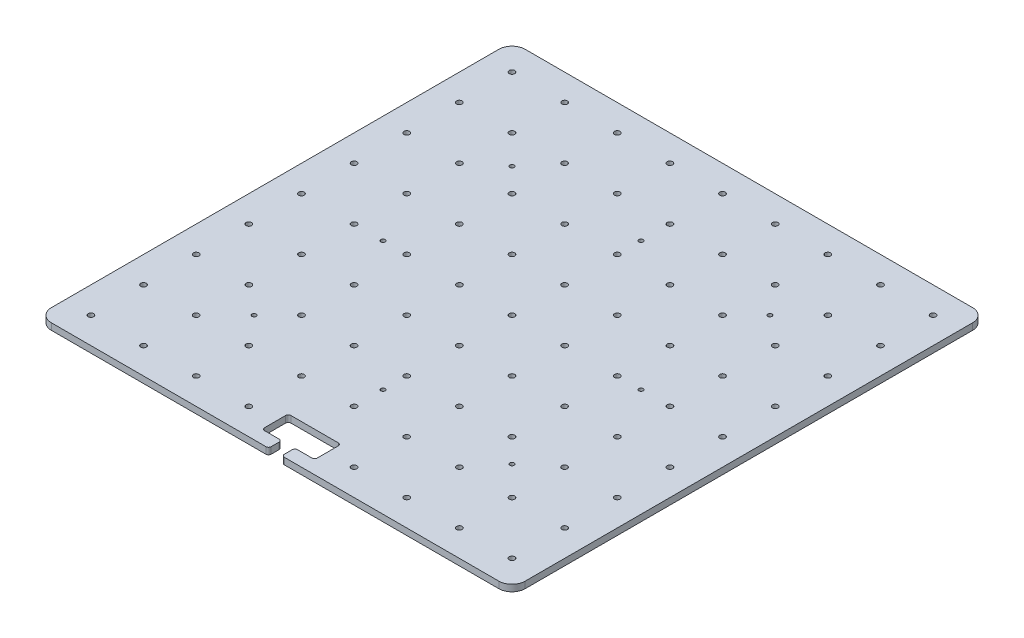
from build123d import *

# Parameters (mm, degrees)
SKETCH_1_W          = 360
SKETCH_1_H          = 360
EXTRUDE_1_DEPTH     = 5
SKETCH_2_R          = 2.1
CUT_EXTRUDE_1_DEPTH = 255.607541129
FILLET_1_R          = 10
CUT_EXTRUDE_2_DEPTH = 255.607541129
SKETCH_4_R          = 1.6
CUT_EXTRUDE_3_DEPTH = 10
FILLET_2_R          = 2


with BuildPart() as part:
    # 草图1 → 凸台-拉伸1 (new body)
    with BuildSketch(Plane(origin=(0, 0, 0), x_dir=(1, 0, 0), z_dir=(0, 1, 0))):
        Rectangle(SKETCH_1_W, SKETCH_1_H)
    extrude(amount=EXTRUDE_1_DEPTH)

    # 草图2 → 切除-拉伸1 (cut, through all)
    with BuildSketch(Plane(origin=(0, 5, 0), x_dir=(1, 0, 0), z_dir=(0, 1, 0))):
        with Locations(Location((0, 0, 0), (0, 0, 270))):
            Circle(SKETCH_2_R)
        with Locations(Location((40, 0, 0), (0, 0, 270))):
            Circle(SKETCH_2_R)
        with Locations(Location((80, 0, 0), (0, 0, 270))):
            Circle(SKETCH_2_R)
        with Locations(Location((120, 0, 0), (0, 0, 270))):
            Circle(SKETCH_2_R)
        with Locations(Location((160, 0, 0), (0, 0, 270))):
            Circle(SKETCH_2_R)
        with Locations(Location((40, 40, 0), (0, 0, 270))):
            Circle(SKETCH_2_R)
        with Locations(Location((80, 40, 0), (0, 0, 270))):
            Circle(SKETCH_2_R)
        with Locations(Location((120, 40, 0), (0, 0, 270))):
            Circle(SKETCH_2_R)
        with Locations(Location((160, 40, 0), (0, 0, 270))):
            Circle(SKETCH_2_R)
        with Locations(Location((40, 80, 0), (0, 0, 270))):
            Circle(SKETCH_2_R)
        with Locations(Location((80, 80, 0), (0, 0, 270))):
            Circle(SKETCH_2_R)
        with Locations(Location((120, 80, 0), (0, 0, 270))):
            Circle(SKETCH_2_R)
        with Locations(Location((160, 80, 0), (0, 0, 270))):
            Circle(SKETCH_2_R)
        with Locations(Location((40, 120, 0), (0, 0, 270))):
            Circle(SKETCH_2_R)
        with Locations(Location((80, 120, 0), (0, 0, 270))):
            Circle(SKETCH_2_R)
        with Locations(Location((120, 120, 0), (0, 0, 270))):
            Circle(SKETCH_2_R)
        with Locations(Location((160, 120, 0), (0, 0, 270))):
            Circle(SKETCH_2_R)
        with Locations(Location((40, 160, 0), (0, 0, 270))):
            Circle(SKETCH_2_R)
        with Locations(Location((80, 160, 0), (0, 0, 270))):
            Circle(SKETCH_2_R)
        with Locations(Location((120, 160, 0), (0, 0, 270))):
            Circle(SKETCH_2_R)
        with Locations(Location((160, 160, 0), (0, 0, 270))):
            Circle(SKETCH_2_R)
        with Locations(Location((0, 40, 0), (0, 0, 270))):
            Circle(SKETCH_2_R)
        with Locations(Location((0, 80, 0), (0, 0, 270))):
            Circle(SKETCH_2_R)
        with Locations(Location((0, 120, 0), (0, 0, 270))):
            Circle(SKETCH_2_R)
        with Locations(Location((0, 160, 0), (0, 0, 270))):
            Circle(SKETCH_2_R)
        with Locations(Location((0, -160, 0), (0, 0, 90))):
            Circle(SKETCH_2_R)
        with Locations(Location((0, -120, 0), (0, 0, 90))):
            Circle(SKETCH_2_R)
        with Locations(Location((0, -80, 0), (0, 0, 90))):
            Circle(SKETCH_2_R)
        with Locations(Location((0, -40, 0), (0, 0, 90))):
            Circle(SKETCH_2_R)
        with Locations(Location((160, -160, 0), (0, 0, 90))):
            Circle(SKETCH_2_R)
        with Locations(Location((120, -160, 0), (0, 0, 90))):
            Circle(SKETCH_2_R)
        with Locations(Location((80, -160, 0), (0, 0, 90))):
            Circle(SKETCH_2_R)
        with Locations(Location((40, -160, 0), (0, 0, 90))):
            Circle(SKETCH_2_R)
        with Locations(Location((160, -120, 0), (0, 0, 90))):
            Circle(SKETCH_2_R)
        with Locations(Location((120, -120, 0), (0, 0, 90))):
            Circle(SKETCH_2_R)
        with Locations(Location((80, -120, 0), (0, 0, 90))):
            Circle(SKETCH_2_R)
        with Locations(Location((40, -120, 0), (0, 0, 90))):
            Circle(SKETCH_2_R)
        with Locations(Location((160, -80, 0), (0, 0, 90))):
            Circle(SKETCH_2_R)
        with Locations(Location((120, -80, 0), (0, 0, 90))):
            Circle(SKETCH_2_R)
        with Locations(Location((80, -80, 0), (0, 0, 90))):
            Circle(SKETCH_2_R)
        with Locations(Location((40, -80, 0), (0, 0, 90))):
            Circle(SKETCH_2_R)
        with Locations(Location((160, -40, 0), (0, 0, 90))):
            Circle(SKETCH_2_R)
        with Locations(Location((120, -40, 0), (0, 0, 90))):
            Circle(SKETCH_2_R)
        with Locations(Location((80, -40, 0), (0, 0, 90))):
            Circle(SKETCH_2_R)
        with Locations(Location((40, -40, 0), (0, 0, 90))):
            Circle(SKETCH_2_R)
        with Locations(Location((-40, -40, 0), (0, 0, 270))):
            Circle(SKETCH_2_R)
        with Locations(Location((-80, -40, 0), (0, 0, 270))):
            Circle(SKETCH_2_R)
        with Locations(Location((-120, -40, 0), (0, 0, 270))):
            Circle(SKETCH_2_R)
        with Locations(Location((-160, -40, 0), (0, 0, 270))):
            Circle(SKETCH_2_R)
        with Locations(Location((-40, -80, 0), (0, 0, 270))):
            Circle(SKETCH_2_R)
        with Locations(Location((-80, -80, 0), (0, 0, 270))):
            Circle(SKETCH_2_R)
        with Locations(Location((-120, -80, 0), (0, 0, 270))):
            Circle(SKETCH_2_R)
        with Locations(Location((-160, -80, 0), (0, 0, 270))):
            Circle(SKETCH_2_R)
        with Locations(Location((-40, -120, 0), (0, 0, 270))):
            Circle(SKETCH_2_R)
        with Locations(Location((-80, -120, 0), (0, 0, 270))):
            Circle(SKETCH_2_R)
        with Locations(Location((-120, -120, 0), (0, 0, 270))):
            Circle(SKETCH_2_R)
        with Locations(Location((-160, -120, 0), (0, 0, 270))):
            Circle(SKETCH_2_R)
        with Locations(Location((-40, -160, 0), (0, 0, 270))):
            Circle(SKETCH_2_R)
        with Locations(Location((-80, -160, 0), (0, 0, 270))):
            Circle(SKETCH_2_R)
        with Locations(Location((-120, -160, 0), (0, 0, 270))):
            Circle(SKETCH_2_R)
        with Locations(Location((-160, -160, 0), (0, 0, 270))):
            Circle(SKETCH_2_R)
        with Locations(Location((-160, 160, 0), (0, 0, 90))):
            Circle(SKETCH_2_R)
        with Locations(Location((-120, 160, 0), (0, 0, 90))):
            Circle(SKETCH_2_R)
        with Locations(Location((-80, 160, 0), (0, 0, 90))):
            Circle(SKETCH_2_R)
        with Locations(Location((-40, 160, 0), (0, 0, 90))):
            Circle(SKETCH_2_R)
        with Locations(Location((-160, 120, 0), (0, 0, 90))):
            Circle(SKETCH_2_R)
        with Locations(Location((-120, 120, 0), (0, 0, 90))):
            Circle(SKETCH_2_R)
        with Locations(Location((-80, 120, 0), (0, 0, 90))):
            Circle(SKETCH_2_R)
        with Locations(Location((-40, 120, 0), (0, 0, 90))):
            Circle(SKETCH_2_R)
        with Locations(Location((-160, 80, 0), (0, 0, 90))):
            Circle(SKETCH_2_R)
        with Locations(Location((-120, 80, 0), (0, 0, 90))):
            Circle(SKETCH_2_R)
        with Locations(Location((-80, 80, 0), (0, 0, 90))):
            Circle(SKETCH_2_R)
        with Locations(Location((-40, 80, 0), (0, 0, 90))):
            Circle(SKETCH_2_R)
        with Locations(Location((-160, 40, 0), (0, 0, 90))):
            Circle(SKETCH_2_R)
        with Locations(Location((-120, 40, 0), (0, 0, 90))):
            Circle(SKETCH_2_R)
        with Locations(Location((-80, 40, 0), (0, 0, 90))):
            Circle(SKETCH_2_R)
        with Locations(Location((-40, 40, 0), (0, 0, 90))):
            Circle(SKETCH_2_R)
        with Locations(Location((-160, 0, 0), (0, 0, 90))):
            Circle(SKETCH_2_R)
        with Locations(Location((-120, 0, 0), (0, 0, 90))):
            Circle(SKETCH_2_R)
        with Locations(Location((-80, 0, 0), (0, 0, 90))):
            Circle(SKETCH_2_R)
        with Locations(Location((-40, 0, 0), (0, 0, 90))):
            Circle(SKETCH_2_R)
    extrude(amount=-CUT_EXTRUDE_1_DEPTH, mode=Mode.SUBTRACT)

    # 圆角1
    fillet_1_edges = [part.edges().sort_by_distance(p)[0] for p in [
        (180, 2.5, 180),
        (-180, 2.5, 180),
        (-180, 2.5, -180),
        (180, 2.5, -180),
    ]]
    fillet(fillet_1_edges, radius=FILLET_1_R)

    # 草图3 → 切除-拉伸2 (cut, through all)
    with BuildSketch(Plane(origin=(0, 5, 0), x_dir=(1, 0, 0), z_dir=(0, 1, 0))):
        Polygon((5, -180), (5, -170), (20, -170), (20, -150), (-20, -150), (-20, -170), (-5, -170), (-5, -180), align=None)
    extrude(amount=-CUT_EXTRUDE_2_DEPTH, mode=Mode.SUBTRACT)

    # 草图4 → 切除-拉伸3 (cut)
    with BuildSketch(Plane(origin=(0, 5, 0), x_dir=(1, 0, 0), z_dir=(0, 1, 0))):
        with Locations(Location((98, 98, 0), (0, 0, 270))):
            Circle(SKETCH_4_R)
        with Locations(Location((98, -98, 0), (0, 0, 270))):
            Circle(SKETCH_4_R)
        with Locations(Location((-98, -98, 0), (0, 0, 270))):
            Circle(SKETCH_4_R)
        with Locations(Location((-98, 98, 0), (0, 0, 270))):
            Circle(SKETCH_4_R)
        with Locations(Location((98, 0, 0), (0, 0, 270))):
            Circle(SKETCH_4_R)
        with Locations(Location((-98, 0, 0), (0, 0, 270))):
            Circle(SKETCH_4_R)
        with Locations(Location((0, 98, 0), (0, 0, 270))):
            Circle(SKETCH_4_R)
        with Locations(Location((0, -98, 0), (0, 0, 270))):
            Circle(SKETCH_4_R)
    extrude(amount=-CUT_EXTRUDE_3_DEPTH, mode=Mode.SUBTRACT)

    # 圆角2
    fillet_2_edges = [part.edges().sort_by_distance(p)[0] for p in [
        (-5, 2.5, 180),
        (-5, 2.5, 170),
        (-20, 2.5, 170),
        (-20, 2.5, 150),
        (20, 2.5, 150),
        (20, 2.5, 170),
        (5, 2.5, 170),
        (5, 2.5, 180),
    ]]
    fillet(fillet_2_edges, radius=FILLET_2_R)


solid = part.part
